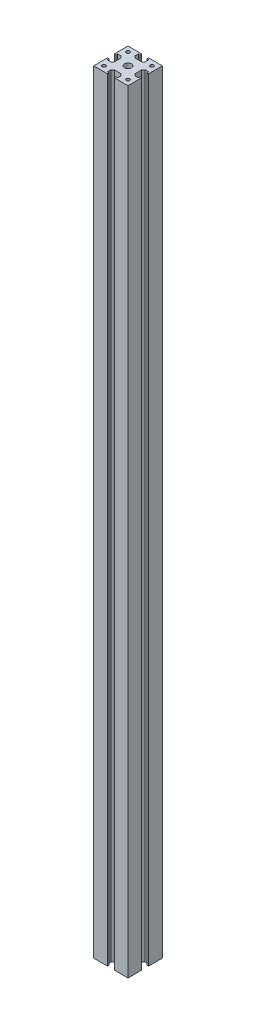
from build123d import *

# Parameters (mm, degrees)
SKETCH_1_R      = 2
SKETCH_1_R_2    = 1
EXTRUDE_1_DEPTH = 225


with BuildPart() as part:
    # 草圖1 → 填料-伸長1 (new, symmetric)
    with BuildSketch(Plane(origin=(0, 0, 0), x_dir=(1, 0, 0), z_dir=(0, 1, 0))):
        Polygon((-10, -10), (-2, -10), (-2, -9), (-3, -9), (-3, -7), (-2, -6), (2, -6), (3, -7), (3, -9), (2, -9), (2, -10), (10, -10), (10, -2), (9, -2), (9, -3), (7, -3), (6, -2), (6, 2), (7, 3), (9, 3), (9, 2), (10, 2), (10, 10), (2, 10), (2, 9), (3, 9), (3, 7), (2, 6), (-2, 6), (-3, 7), (-3, 9), (-2, 9), (-2, 10), (-10, 10), (-10, 2), (-9, 2), (-9, 3), (-7, 3), (-6, 2), (-6, -2), (-7, -3), (-9, -3), (-9, -2), (-10, -2), align=None)
        with Locations(Location((0, 0, 0), (0, 0, 270))):
            Circle(SKETCH_1_R, mode=Mode.SUBTRACT)
        with Locations(Location((-7, 7, 0), (0, 0, 270))):
            Circle(SKETCH_1_R_2, mode=Mode.SUBTRACT)
        with Locations(Location((7, 7, 0), (0, 0, 270))):
            Circle(SKETCH_1_R_2, mode=Mode.SUBTRACT)
        with Locations(Location((7, -7, 0), (0, 0, 270))):
            Circle(SKETCH_1_R_2, mode=Mode.SUBTRACT)
        with Locations(Location((-7, -7, 0), (0, 0, 270))):
            Circle(SKETCH_1_R_2, mode=Mode.SUBTRACT)
    extrude(amount=EXTRUDE_1_DEPTH, both=True)


solid = part.part
